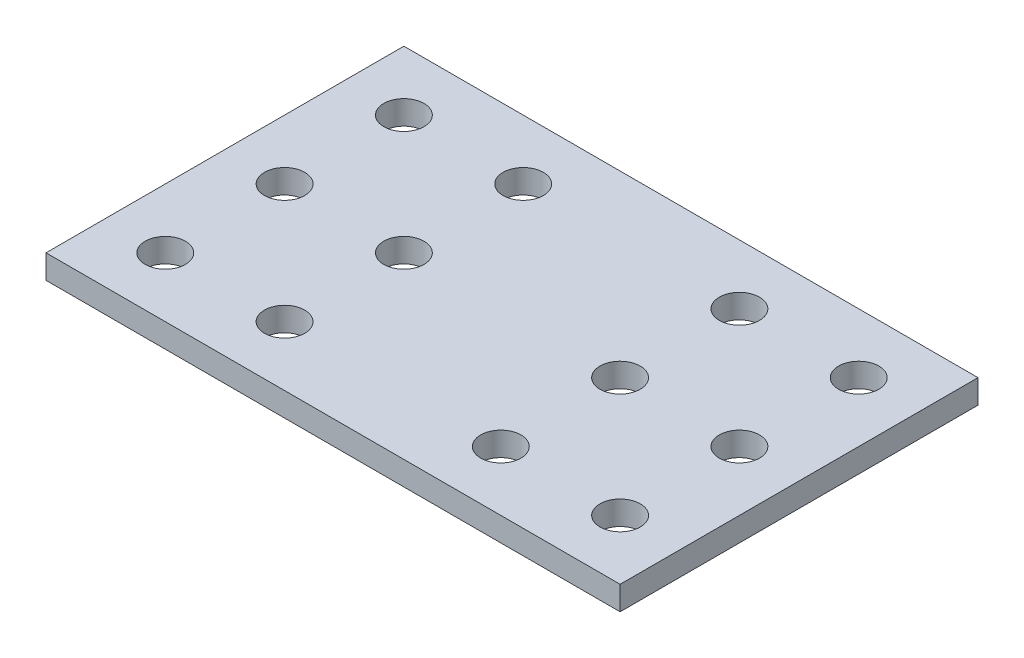
from build123d import *

# Parameters (mm, degrees)
SKETCH_1_W                       = 385
SKETCH_1_H                       = 240
EXTRUDE_1_DEPTH                  = 16
SKETCH_2_R                       = 13.5
CUT_EXTRUDE_1_DEPTH              = 454.961452108
PATTERN_LINEAR_1_COUNT           = 2
PATTERN_LINEAR_1_PITCH           = 80
PATTERN_LINEAR_2_COUNT           = 2
PATTERN_LINEAR_2_PITCH           = 80
PATTERN_LINEAR_3_COUNT           = 2
PATTERN_LINEAR_3_PITCH           = 80
PATTERN_LINEAR_3_COPY_1_SKETCH_R = 13.5
PATTERN_LINEAR_3_COPY_1_DEPTH    = 454.961452108
PATTERN_LINEAR_3_COPY_2_SKETCH_R = 13.5
PATTERN_LINEAR_3_COPY_2_DEPTH    = 454.961452108
PATTERN_LINEAR_4_COUNT           = 2
PATTERN_LINEAR_4_PITCH           = 225
PATTERN_LINEAR_4_COPY_1_SKETCH_R = 13.5
PATTERN_LINEAR_4_COPY_1_DEPTH    = 454.961452108
PATTERN_LINEAR_4_COPY_2_SKETCH_R = 13.5
PATTERN_LINEAR_4_COPY_2_DEPTH    = 454.961452108
PATTERN_LINEAR_4_COPY_3_SKETCH_R = 13.5
PATTERN_LINEAR_4_COPY_3_DEPTH    = 454.961452108
PATTERN_LINEAR_4_COPY_4_SKETCH_R = 13.5
PATTERN_LINEAR_4_COPY_4_DEPTH    = 454.961452108
PATTERN_LINEAR_4_COPY_5_SKETCH_R = 13.5
PATTERN_LINEAR_4_COPY_5_DEPTH    = 454.961452108


with BuildPart() as part:
    # 草图1 → 凸台-拉伸1 (new body)
    with BuildSketch(Plane(origin=(0, 0, 0), x_dir=(1, 0, 0), z_dir=(0, 1, 0))):
        with Locations((192.5, 120)):
            Rectangle(SKETCH_1_W, SKETCH_1_H)
    extrude(amount=EXTRUDE_1_DEPTH)

    # 草图2 → 切除-拉伸1 (cut, through all)
    with BuildSketch(Plane(origin=(0, 16, 0), x_dir=(1, 0, 0), z_dir=(0, 1, 0))):
        with Locations(Location((120, 120, 0), (0, 0, 270))):
            Circle(SKETCH_2_R)
    cut_extrude_1 = extrude(amount=-CUT_EXTRUDE_1_DEPTH, mode=Mode.SUBTRACT)

    # 阵列(线性)1: 切除-拉伸1 ×2
    with Locations(*[(0, 0, -i * PATTERN_LINEAR_1_PITCH) for i in range(1, PATTERN_LINEAR_1_COUNT)]):
        add(cut_extrude_1, mode=Mode.SUBTRACT)

    # 阵列(线性)2: 切除-拉伸1 ×2
    with Locations(*[(0, 0, i * PATTERN_LINEAR_2_PITCH) for i in range(1, PATTERN_LINEAR_2_COUNT)]):
        add(cut_extrude_1, mode=Mode.SUBTRACT)

    # 阵列(线性)3: 切除-拉伸1 ×2
    with Locations(*[(-i * PATTERN_LINEAR_3_PITCH, 0, 0) for i in range(1, PATTERN_LINEAR_3_COUNT)]):
        add(cut_extrude_1, mode=Mode.SUBTRACT)

    # 阵列(线性)3 copy 1 sketch → 阵列(线性)3 copy 1 (cut, through all)
    with BuildSketch(Plane(origin=(-80, 16, -80), x_dir=(1, 0, 0), z_dir=(0, 1, 0))):
        with Locations(Location((120, 120, 0), (0, 0, 270))):
            Circle(PATTERN_LINEAR_3_COPY_1_SKETCH_R)
    extrude(amount=-PATTERN_LINEAR_3_COPY_1_DEPTH, mode=Mode.SUBTRACT)

    # 阵列(线性)3 copy 2 sketch → 阵列(线性)3 copy 2 (cut, through all)
    with BuildSketch(Plane(origin=(-80, 16, 80), x_dir=(1, 0, 0), z_dir=(0, 1, 0))):
        with Locations(Location((120, 120, 0), (0, 0, 270))):
            Circle(PATTERN_LINEAR_3_COPY_2_SKETCH_R)
    extrude(amount=-PATTERN_LINEAR_3_COPY_2_DEPTH, mode=Mode.SUBTRACT)

    # 阵列(线性)4: 切除-拉伸1 ×2
    with Locations(*[(i * PATTERN_LINEAR_4_PITCH, 0, 0) for i in range(1, PATTERN_LINEAR_4_COUNT)]):
        add(cut_extrude_1, mode=Mode.SUBTRACT)

    # 阵列(线性)4 copy 1 sketch → 阵列(线性)4 copy 1 (cut, through all)
    with BuildSketch(Plane(origin=(225, 16, -80), x_dir=(1, 0, 0), z_dir=(0, 1, 0))):
        with Locations(Location((120, 120, 0), (0, 0, 270))):
            Circle(PATTERN_LINEAR_4_COPY_1_SKETCH_R)
    extrude(amount=-PATTERN_LINEAR_4_COPY_1_DEPTH, mode=Mode.SUBTRACT)

    # 阵列(线性)4 copy 2 sketch → 阵列(线性)4 copy 2 (cut, through all)
    with BuildSketch(Plane(origin=(225, 16, 80), x_dir=(1, 0, 0), z_dir=(0, 1, 0))):
        with Locations(Location((120, 120, 0), (0, 0, 270))):
            Circle(PATTERN_LINEAR_4_COPY_2_SKETCH_R)
    extrude(amount=-PATTERN_LINEAR_4_COPY_2_DEPTH, mode=Mode.SUBTRACT)

    # 阵列(线性)4 copy 3 sketch → 阵列(线性)4 copy 3 (cut, through all)
    with BuildSketch(Plane(origin=(145, 16, 0), x_dir=(1, 0, 0), z_dir=(0, 1, 0))):
        with Locations(Location((120, 120, 0), (0, 0, 270))):
            Circle(PATTERN_LINEAR_4_COPY_3_SKETCH_R)
    extrude(amount=-PATTERN_LINEAR_4_COPY_3_DEPTH, mode=Mode.SUBTRACT)

    # 阵列(线性)4 copy 4 sketch → 阵列(线性)4 copy 4 (cut, through all)
    with BuildSketch(Plane(origin=(145, 16, -80), x_dir=(1, 0, 0), z_dir=(0, 1, 0))):
        with Locations(Location((120, 120, 0), (0, 0, 270))):
            Circle(PATTERN_LINEAR_4_COPY_4_SKETCH_R)
    extrude(amount=-PATTERN_LINEAR_4_COPY_4_DEPTH, mode=Mode.SUBTRACT)

    # 阵列(线性)4 copy 5 sketch → 阵列(线性)4 copy 5 (cut, through all)
    with BuildSketch(Plane(origin=(145, 16, 80), x_dir=(1, 0, 0), z_dir=(0, 1, 0))):
        with Locations(Location((120, 120, 0), (0, 0, 270))):
            Circle(PATTERN_LINEAR_4_COPY_5_SKETCH_R)
    extrude(amount=-PATTERN_LINEAR_4_COPY_5_DEPTH, mode=Mode.SUBTRACT)


solid = part.part
